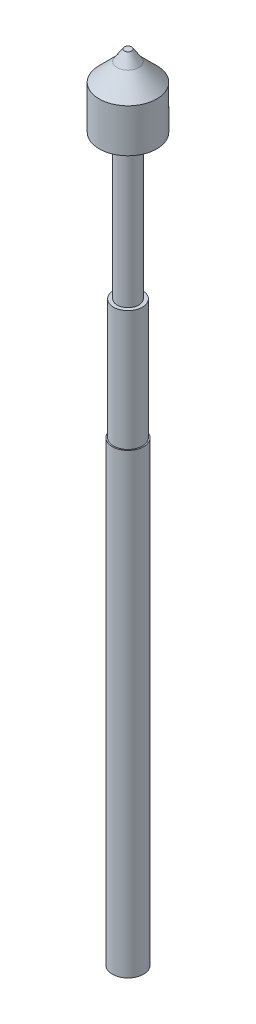
from build123d import *

# Parameters (mm, degrees)
SKETCH_1_R      = 0.65
EXTRUDE_1_DEPTH = 19
SKETCH_2_R      = 0.6
EXTRUDE_2_DEPTH = 5
SKETCH_3_R      = 0.45
EXTRUDE_3_DEPTH = 9


with BuildPart() as part:
    # 草图1 → 凸台-拉伸1 (new body)
    with BuildSketch(Plane(origin=(0, 0, 0), x_dir=(1, 0, 0), z_dir=(0, 1, 0))):
        with Locations(Location((0, 0, 0), (0, 0, 270))):
            Circle(SKETCH_1_R)
    extrude(amount=EXTRUDE_1_DEPTH)

    # 草图2 → 凸台-拉伸2 (add)
    with BuildSketch(Plane(origin=(0, 19, 0), x_dir=(1, 0, 0), z_dir=(0, 1, 0))):
        with Locations(Location((0, 0, 0), (0, 0, 270))):
            Circle(SKETCH_2_R)
    extrude(amount=EXTRUDE_2_DEPTH)

    # 草图3 → 凸台-拉伸3 (add)
    with BuildSketch(Plane(origin=(0, 24, 0), x_dir=(1, 0, 0), z_dir=(0, 1, 0))):
        with Locations(Location((0, 0, 0), (0, 0, 270))):
            Circle(SKETCH_3_R)
    extrude(amount=EXTRUDE_3_DEPTH)

    # 草图6 → 旋转2 (revolve)
    with BuildSketch(Plane.XY, mode=Mode.PRIVATE) as revolve_2_sk:
        Polygon((0, 33), (-1.2, 31.8), (-1.2, 30), (0, 30), align=None)
    revolve(revolve_2_sk.sketch.rotate(Axis((0, 0, 0), (0, -1, 0)), 180), axis=Axis((0, 0, 0), (0, -1, 0)))

    # 草图7 → 切除-旋转5 (revolve, cut)
    with BuildSketch(Plane.XY):
        Polygon((0.45, 33), (0.15, 33), (0.45, 32.55), align=None)
    revolve(axis=Axis((0, 0, 0), (0, -1, 0)), mode=Mode.SUBTRACT)


solid = part.part
